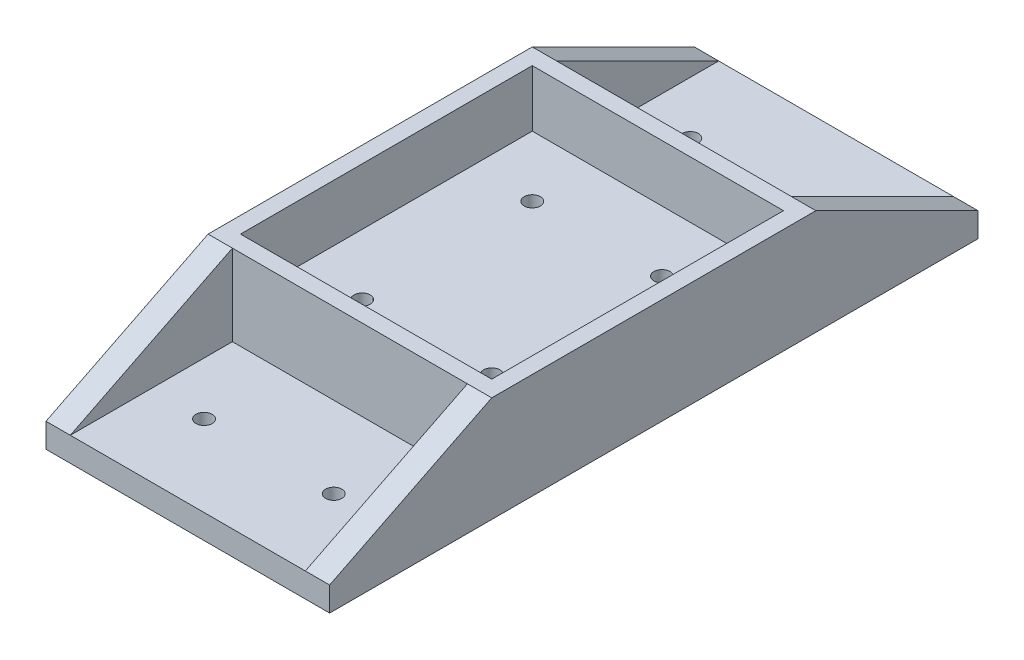
from build123d import *

# Parameters (mm, degrees)
SKETCH1_W           = 35
SKETCH1_H           = 40
BOSS_EXTRUDE1_DEPTH = 10
SKETCH2_W           = 31
SKETCH2_H           = 36
CUT_EXTRUDE1_DEPTH  = 7
SKETCH3_W           = 35
SKETCH3_H           = 80
BOSS_EXTRUDE2_DEPTH = 3
BOSS_EXTRUDE3_DEPTH = 3
SKETCH6_R           = 1
CUT_EXTRUDE2_DEPTH  = 6
SKETCH7_R           = 1
CUT_EXTRUDE3_DEPTH  = 3


with BuildPart() as part:
    # Sketch1 → Boss-Extrude1 (new body)
    with BuildSketch(Plane(origin=(0, 0, 0), x_dir=(1, 0, 0), z_dir=(0, 1, 0))):
        Rectangle(SKETCH1_W, SKETCH1_H)
    extrude(amount=BOSS_EXTRUDE1_DEPTH)

    # Sketch2 → Cut-Extrude1 (cut)
    with BuildSketch(Plane(origin=(0, 10, 0), x_dir=(1, 0, 0), z_dir=(0, 1, 0))):
        Rectangle(SKETCH2_W, SKETCH2_H)
    extrude(amount=-CUT_EXTRUDE1_DEPTH, mode=Mode.SUBTRACT)

    # Sketch3 → Boss-Extrude2 (add)
    with BuildSketch(Plane.XZ):
        Rectangle(SKETCH3_W, SKETCH3_H)
    extrude(amount=BOSS_EXTRUDE2_DEPTH)

    # Sketch5 → Boss-Extrude3 (add)
    with BuildSketch(Plane.ZY.offset(17.5)):
        Polygon((-20, 10), (-20, 0), (-40, 0), align=None)
        Polygon((20, 10), (20, 0), (40, 0), align=None)
    boss_extrude3 = extrude(amount=-BOSS_EXTRUDE3_DEPTH)

    # Mirror1: Boss-Extrude3 across plane
    add(boss_extrude3.mirror(Plane(origin=(0, 0, 0), x_dir=(0, 0, 1), z_dir=(1, 0, 0))))

    # Sketch6 → Cut-Extrude2 (cut)
    with BuildSketch(Plane(origin=(0, 3, 0), x_dir=(1, 0, 0), z_dir=(0, 1, 0))):
        with Locations(Location((-8, 10.5, 0), (0, 0, 270))):
            Circle(SKETCH6_R)
        with Locations(Location((8, 10.5, 0), (0, 0, 270))):
            Circle(SKETCH6_R)
        with Locations(Location((-8, -10.5, 0), (0, 0, 270))):
            Circle(SKETCH6_R)
        with Locations(Location((8, -10.5, 0), (0, 0, 270))):
            Circle(SKETCH6_R)
    extrude(amount=-CUT_EXTRUDE2_DEPTH, mode=Mode.SUBTRACT)

    # Sketch7 → Cut-Extrude3 (cut)
    with BuildSketch(Plane(origin=(0, 0, 0), x_dir=(1, 0, 0), z_dir=(0, 1, 0))):
        with Locations(Location((-8, 30, 0), (0, 0, 270))):
            Circle(SKETCH7_R)
        with Locations(Location((8, 30, 0), (0, 0, 270))):
            Circle(SKETCH7_R)
    cut_extrude3 = extrude(amount=-CUT_EXTRUDE3_DEPTH, mode=Mode.SUBTRACT)

    # Mirror2: Cut-Extrude3 across plane
    add(cut_extrude3.mirror(Plane.XY), mode=Mode.SUBTRACT)


solid = part.part
